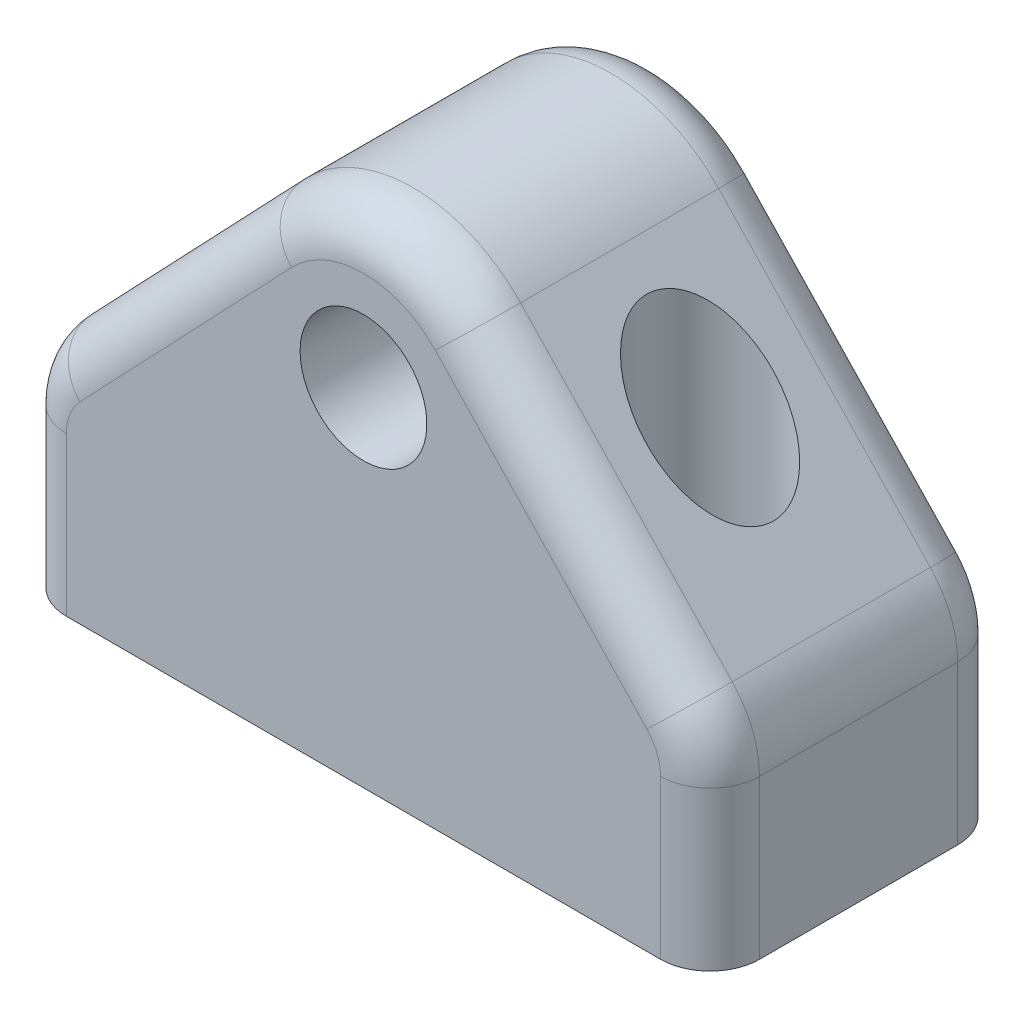
from build123d import *

# Parameters (mm, degrees)
SKETCH1_R           = 2.032
BOSS_EXTRUDE1_DEPTH = 9.525
SKETCH2_R           = 2.032
CUT_EXTRUDE1_DEPTH  = 29.925626614
FILLET1_R           = 1.5875


with BuildPart() as part:
    # Sketch1 → Boss-Extrude1 (new body)
    with BuildSketch(Plane.XY):
        with BuildLine():
            Line((0, 0), (0, 5.08))
            ThreePointArc((0, 5.08), (0.227086506, 6.259165397), (0.875862069, 7.269655172))
            Line((0.875862069, 7.269655172), (7.663793103, 14.396982759))
            ThreePointArc((7.663793103, 14.396982759), (11.1125, 15.875), (14.561206897, 14.396982759))
            Line((14.561206897, 14.396982759), (21.349137931, 7.269655172))
            ThreePointArc((21.349137931, 7.269655172), (21.997913494, 6.259165397), (22.225, 5.08))
            Line((22.225, 5.08), (22.225, 0))
            Line((22.225, 0), (0, 0))
        make_face()
        with Locations(Location((11.1125, 11.1125, 0), (0, 0, 180))):
            Circle(SKETCH1_R, mode=Mode.SUBTRACT)
    extrude(amount=BOSS_EXTRUDE1_DEPTH)

    # Sketch2 → Cut-Extrude1 (cut, through all)
    with BuildSketch(Plane.XZ):
        with Locations(Location((4.7625, 4.7625, 0), (0, 0, 270))):
            Circle(SKETCH2_R)
        with Locations(Location((17.4625, 4.7625, 0), (0, 0, 270))):
            Circle(SKETCH2_R)
    extrude(amount=-CUT_EXTRUDE1_DEPTH, mode=Mode.SUBTRACT)

    # Fillet1
    fillet1_edges = [part.edges().sort_by_distance(p)[0] for p in [
        (17.955172414, 10.833318966, 0),
        (21.997913494, 6.259165397, 0),
        (22.225, 2.54, 0),
        (21.997913494, 6.259165397, 9.525),
        (17.955172414, 10.833318966, 9.525),
        (11.1125, 15.875, 9.525),
        (4.269827586, 10.833318966, 9.525),
        (0.227086506, 6.259165397, 9.525),
        (0, 2.54, 9.525),
        (0, 2.54, 0),
        (22.225, 2.54, 9.525),
        (0.227086506, 6.259165397, 0),
        (4.269827586, 10.833318966, 0),
        (11.1125, 15.875, 0),
    ]]
    fillet(fillet1_edges, radius=FILLET1_R)


solid = part.part
